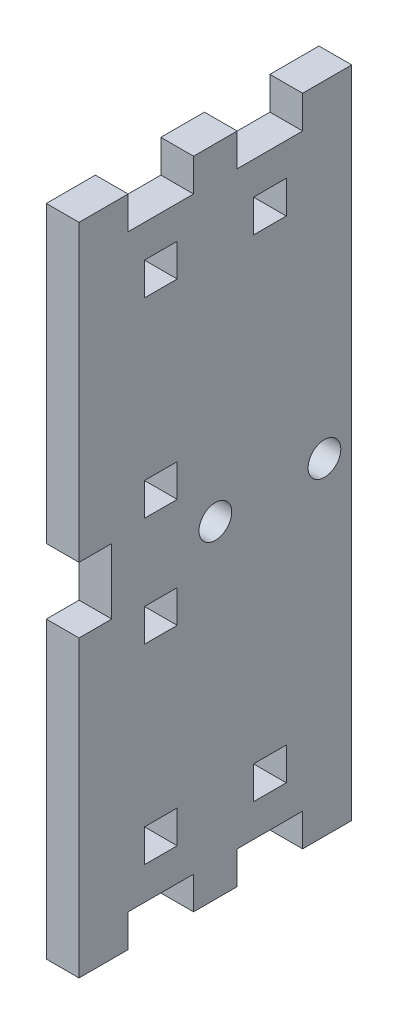
from build123d import *

# Parameters (mm, degrees)
BOSS_EXTRUDE1_DEPTH = 3
SKETCH2_W           = 3
SKETCH2_H           = 3
CUT_EXTRUDE1_DEPTH  = 3
SKETCH3_R           = 1.5
CUT_EXTRUDE2_DEPTH  = 3
SKETCH4_W           = 3
SKETCH4_H           = 6
SKETCH4_H_2         = 3
CUT_EXTRUDE3_DEPTH  = 10


with BuildPart() as part:
    # Sketch1 → Boss-Extrude1 (new body)
    with BuildSketch(Plane(origin=(0, 0, 0), x_dir=(0, 0, -1), z_dir=(1, 0, 0))):
        Polygon((8, 30), (12.5, 30), (12.5, -30), (8, -30), (8, -27), (2, -27), (2, -30), (-2, -30), (-2, -27), (-8, -27), (-8, -30), (-12.5, -30), (-12.5, 30), (-8, 30), (-8, 27), (-2, 27), (-2, 30), (2, 30), (2, 27), (8, 27), align=None)
    extrude(amount=BOSS_EXTRUDE1_DEPTH)

    # Sketch2 → Cut-Extrude1 (cut)
    with BuildSketch(Plane(origin=(3, 0, 0), x_dir=(0, 0, -1), z_dir=(1, 0, 0))):
        with Locations((-5, 22.5)):
            Rectangle(SKETCH2_W, SKETCH2_H)
        with Locations((5, 22.5)):
            Rectangle(SKETCH2_W, SKETCH2_H)
        with Locations((5, -22.5)):
            Rectangle(SKETCH2_W, SKETCH2_H)
        with Locations((-5, -22.5)):
            Rectangle(SKETCH2_W, SKETCH2_H)
    extrude(amount=-CUT_EXTRUDE1_DEPTH, mode=Mode.SUBTRACT)

    # Sketch3 → Cut-Extrude2 (cut)
    with BuildSketch(Plane(origin=(3, 0, 0), x_dir=(0, 0, -1), z_dir=(1, 0, 0))):
        Circle(SKETCH3_R)
        with Locations((10, 0)):
            Circle(SKETCH3_R)
    extrude(amount=-CUT_EXTRUDE2_DEPTH, mode=Mode.SUBTRACT)

    # Sketch4 → Cut-Extrude3 (cut)
    with BuildSketch(Plane(origin=(3, 0, 0), x_dir=(0, 0, -1), z_dir=(1, 0, 0))):
        with Locations((-11, 0)):
            Rectangle(SKETCH4_W, SKETCH4_H)
        with Locations((-5, 5)):
            Rectangle(SKETCH4_W, SKETCH4_H_2)
        with Locations((-5, -5)):
            Rectangle(SKETCH4_W, SKETCH4_H_2)
    extrude(amount=-CUT_EXTRUDE3_DEPTH, mode=Mode.SUBTRACT)


solid = part.part
